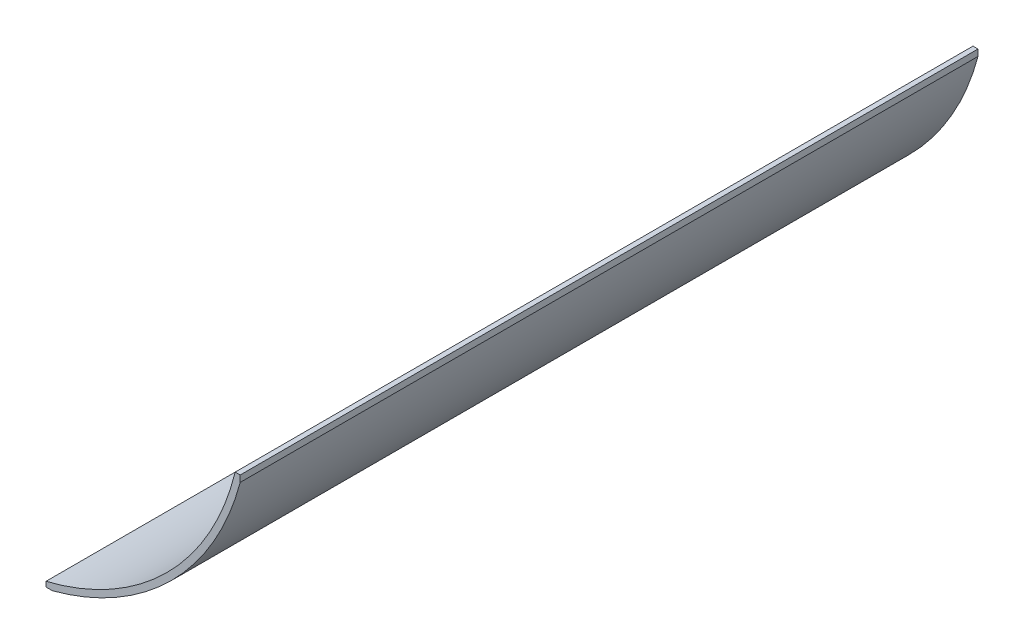
from build123d import *

# Parameters (mm, degrees)
EXTRUDE_1_DEPTH = 114.5


with BuildPart() as part:
    # Эскиз1 → Бобышка-Вытянуть1 (new body)
    with BuildSketch(Plane.XY.offset(111.5)):
        with BuildLine():
            Line((9.5, -38.855501541), (9.5, -39.632688529))
            Line((9.5, -39.632688529), (10.5, -39.632688529))
            ThreePointArc((10.5, -39.632688529), (28.991378029, -28.991378029), (39.632688529, -10.5))
            Line((39.632688529, -10.5), (39.632688529, -9.5))
            Line((39.632688529, -9.5), (38.855501541, -9.5))
            ThreePointArc((38.855501541, -9.5), (28.284271247, -28.284271247), (9.5, -38.855501541))
        make_face()
    extrude(amount=-EXTRUDE_1_DEPTH)


solid = part.part
